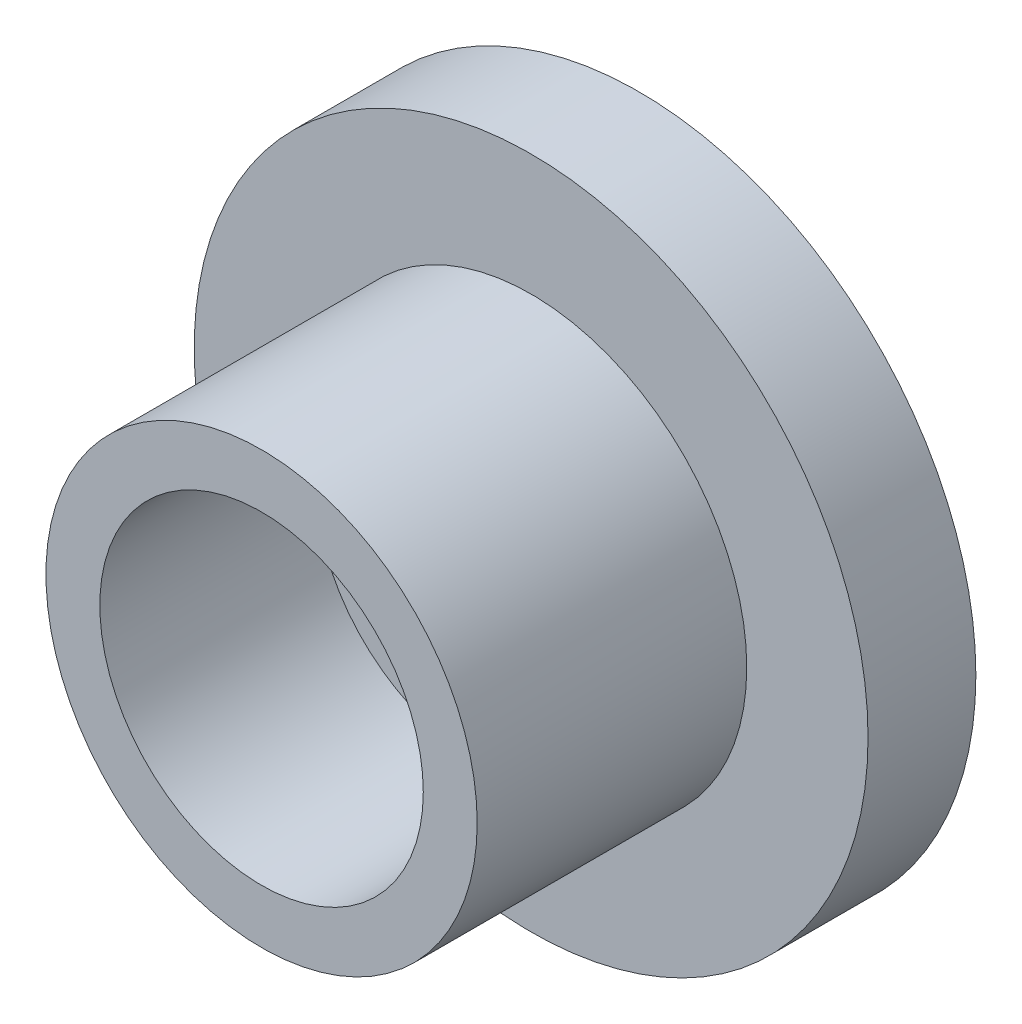
from build123d import *

# Parameters (mm, degrees)
SKETCH_1_R          = 12.5
EXTRUDE_1_DEPTH     = 4
SKETCH_2_R          = 8
EXTRUDE_2_DEPTH     = 10
SKETCH_3_R          = 2.5
CUT_EXTRUDE_1_DEPTH = 23.549944568
SKETCH_4_R          = 6
CUT_EXTRUDE_2_DEPTH = 8
CUT_EXTRUDE_START   = -5
SKETCH_5_R          = 6
CUT_EXTRUDE_3_DEPTH = 5


with BuildPart() as part:
    # 草图1 → 凸台-拉伸1 (new body)
    with BuildSketch(Plane.XY):
        Circle(SKETCH_1_R)
    extrude(amount=EXTRUDE_1_DEPTH)

    # 草图2 → 凸台-拉伸2 (add)
    with BuildSketch(Plane.XY.offset(4)):
        Circle(SKETCH_2_R)
    extrude(amount=EXTRUDE_2_DEPTH)

    # 草图3 → 切除-拉伸1 (cut, through all)
    with BuildSketch(Plane.XY.offset(14)):
        Circle(SKETCH_3_R)
    extrude(amount=-CUT_EXTRUDE_1_DEPTH, mode=Mode.SUBTRACT)

    # 草图4 → 切除-拉伸2 (cut)
    with BuildSketch(Plane.XY.offset(14)):
        Circle(SKETCH_4_R)
    extrude(amount=-CUT_EXTRUDE_2_DEPTH, mode=Mode.SUBTRACT)

    # 草图5 → 切除-拉伸3 (cut)
    with BuildSketch(Plane(origin=(0, 0, 0), x_dir=(-1, 0, 0), z_dir=(0, 0, -1)).offset(CUT_EXTRUDE_START)):
        with Locations(Location((0, 0, 0), (0, 0, 180))):
            Circle(SKETCH_5_R)
    extrude(amount=CUT_EXTRUDE_3_DEPTH, mode=Mode.SUBTRACT)


solid = part.part
